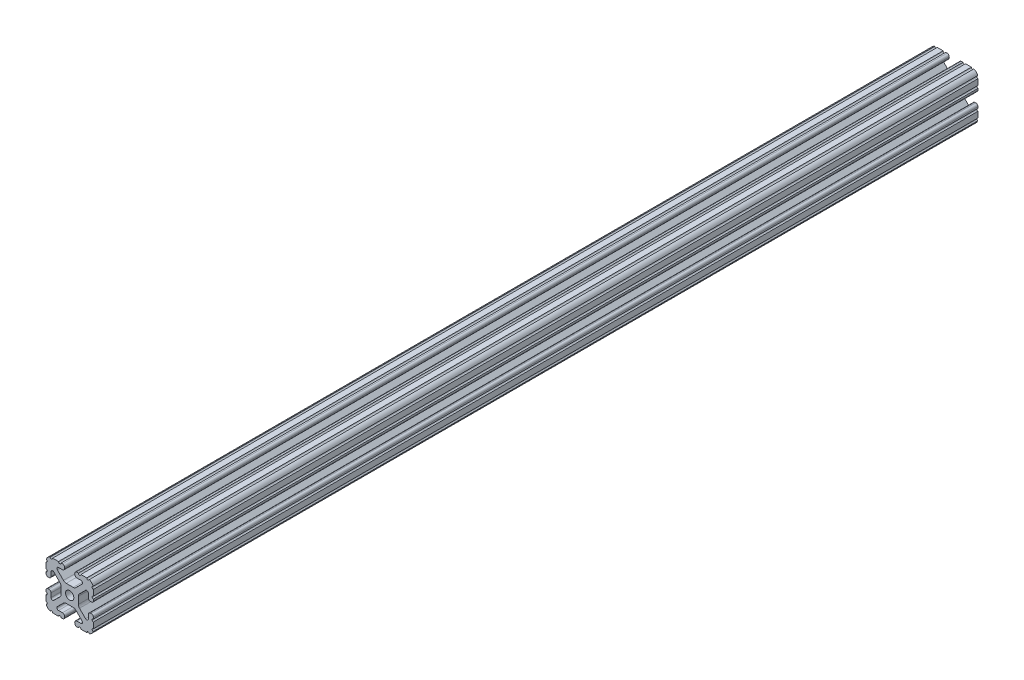
from build123d import *

# Parameters (mm, degrees)
BOSS_EXTRUDE1_DEPTH     = 355.6
CUT_EXTRUDE1_DEPTH      = 357.619075485
CUT_EXTRUDE1_DEPTH_BACK = 357.619075485
SKETCH5_R               = 1.016


with BuildPart() as part:
    # Sketch4 → Boss-Extrude1 (new, symmetric)
    with BuildSketch(Plane.XY):
        with BuildLine():
            Line((5.7912, -19.05), (14.3002, -19.05))
            ThreePointArc((14.3002, -19.05), (17.658815789, -17.658815789), (19.05, -14.3002))
            Line((19.05, -14.3002), (19.05, -5.7912))
            ThreePointArc((19.05, -5.7912), (18.544114832, -4.569885168), (17.3228, -4.064))
            Line((17.3228, -4.064), (16.7132, -4.064))
            ThreePointArc((16.7132, -4.064), (15.491885168, -4.569885168), (14.986, -5.7912))
            Line((14.986, -5.7912), (14.986, -8.996305235))
            ThreePointArc((14.986, -8.996305235), (14.189232738, -10.188751711), (12.782646215, -9.908964256))
            Line((12.782646215, -9.908964256), (7.888897763, -5.015215804))
            ThreePointArc((7.888897763, -5.015215804), (7.219915375, -4.014012907), (6.985, -2.833013566))
            Line((6.985, -2.833013566), (6.985, 0))
            Line((6.985, 0), (3.3274, 0))
            ThreePointArc((3.3274, 0), (2.352827104, -2.352827104), (0, -3.3274))
            Line((0, -3.3274), (0, -6.985))
            Line((0, -6.985), (2.833013566, -6.985))
            ThreePointArc((2.833013566, -6.985), (4.014012907, -7.219915375), (5.015215804, -7.888897763))
            Line((5.015215804, -7.888897763), (9.908964256, -12.782646215))
            ThreePointArc((9.908964256, -12.782646215), (10.188751711, -14.189232738), (8.996305235, -14.986))
            Line((8.996305235, -14.986), (5.7912, -14.986))
            ThreePointArc((5.7912, -14.986), (4.569885168, -15.491885168), (4.064, -16.7132))
            Line((4.064, -16.7132), (4.064, -17.3228))
            ThreePointArc((4.064, -17.3228), (4.569885168, -18.544114832), (5.7912, -19.05))
        make_face()
    extrude(amount=BOSS_EXTRUDE1_DEPTH, both=True)

    # Sketch5 → Cut-Extrude1 (cut, two sides: drawn at the far end of the back side and taken through both)
    with BuildSketch(Plane.XY.offset(-CUT_EXTRUDE1_DEPTH_BACK)):
        with Locations((14.739477062, -19.05)):
            Circle(SKETCH5_R)
        with Locations((7.980305235, -19.05)):
            Circle(SKETCH5_R)
        with Locations((19.05, -14.739477062)):
            Circle(SKETCH5_R)
        with Locations((19.05, -7.980305235)):
            Circle(SKETCH5_R)
    extrude(amount=CUT_EXTRUDE1_DEPTH + CUT_EXTRUDE1_DEPTH_BACK, mode=Mode.SUBTRACT)

    # Mirror1: part across plane


with BuildPart() as part_1:
    add(part.part)
    add(part.part.mirror(Plane(origin=(0, 0, 0), x_dir=(0, 0, 1), z_dir=(1, 0, 0))))

    # Mirror2: part across plane


with BuildPart() as part_2:
    add(part_1.part)
    add(part_1.part.mirror(Plane.ZX))


solid = part_2.part
